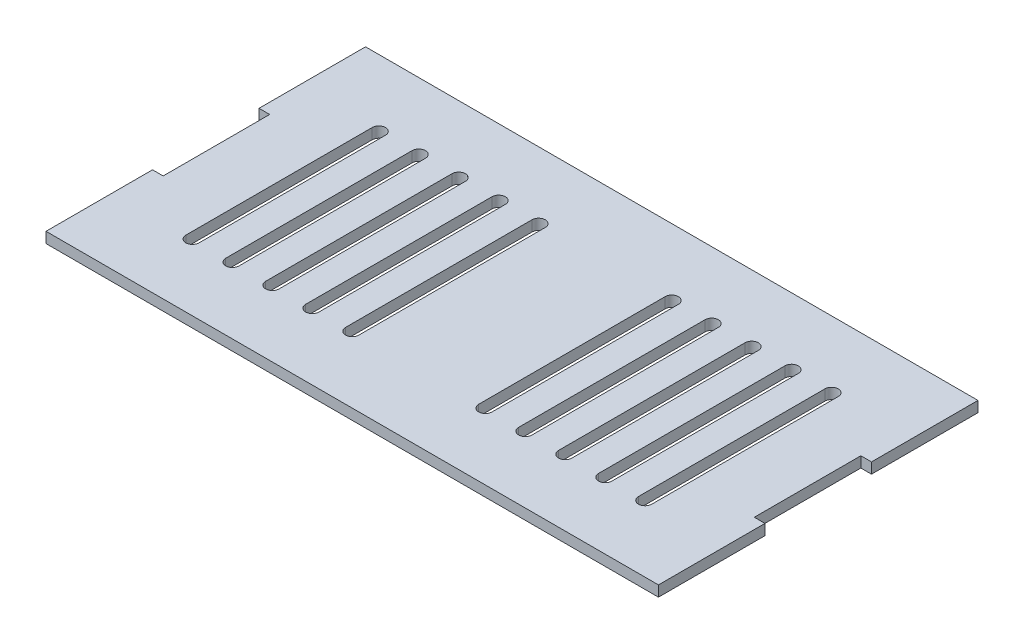
from build123d import *

# Parameters (mm, degrees)
BOSS_EXTRUDE1_DEPTH = 4
CUT_EXTRUDE1_DEPTH  = 4


with BuildPart() as part:
    # Sketch1 → Boss-Extrude1 (new body)
    with BuildSketch(Plane(origin=(0, 0, 0), x_dir=(1, 0, 0), z_dir=(0, 1, 0))):
        Polygon((-115, 60), (115, 60), (115, 20), (111, 20), (111, -20), (115, -20), (115, -60), (-115, -60), (-115, -20), (-111, -20), (-111, 20), (-115, 20), align=None)
    extrude(amount=BOSS_EXTRUDE1_DEPTH)

    # Sketch2 → Cut-Extrude1 (cut)
    with BuildSketch(Plane.XZ):
        with BuildLine():
            Line((-87.5, -35), (-87.5, 35))
            ThreePointArc((-87.5, 35), (-85, 37.5), (-82.5, 35))
            Line((-82.5, 35), (-82.5, -35))
            ThreePointArc((-82.5, -35), (-85, -37.5), (-87.5, -35))
        make_face()
        with BuildLine():
            Line((-72.5, -35), (-72.5, 35))
            ThreePointArc((-72.5, 35), (-70, 37.5), (-67.5, 35))
            Line((-67.5, 35), (-67.5, -35))
            ThreePointArc((-67.5, -35), (-70, -37.5), (-72.5, -35))
        make_face()
        with BuildLine():
            Line((-57.5, -35), (-57.5, 35))
            ThreePointArc((-57.5, 35), (-55, 37.5), (-52.5, 35))
            Line((-52.5, 35), (-52.5, -35))
            ThreePointArc((-52.5, -35), (-55, -37.5), (-57.5, -35))
        make_face()
        with BuildLine():
            Line((-42.5, -35), (-42.5, 35))
            ThreePointArc((-42.5, 35), (-40, 37.5), (-37.5, 35))
            Line((-37.5, 35), (-37.5, -35))
            ThreePointArc((-37.5, -35), (-40, -37.5), (-42.5, -35))
        make_face()
        with BuildLine():
            Line((-27.5, -35), (-27.5, 35))
            ThreePointArc((-27.5, 35), (-25, 37.5), (-22.5, 35))
            Line((-22.5, 35), (-22.5, -35))
            ThreePointArc((-22.5, -35), (-25, -37.5), (-27.5, -35))
        make_face()
        with BuildLine():
            Line((87.5, -35), (87.5, 35))
            ThreePointArc((87.5, 35), (85, 37.5), (82.5, 35))
            Line((82.5, 35), (82.5, -35))
            ThreePointArc((82.5, -35), (85, -37.5), (87.5, -35))
        make_face()
        with BuildLine():
            Line((72.5, -35), (72.5, 35))
            ThreePointArc((72.5, 35), (70, 37.5), (67.5, 35))
            Line((67.5, 35), (67.5, -35))
            ThreePointArc((67.5, -35), (70, -37.5), (72.5, -35))
        make_face()
        with BuildLine():
            Line((57.5, -35), (57.5, 35))
            ThreePointArc((57.5, 35), (55, 37.5), (52.5, 35))
            Line((52.5, 35), (52.5, -35))
            ThreePointArc((52.5, -35), (55, -37.5), (57.5, -35))
        make_face()
        with BuildLine():
            Line((42.5, -35), (42.5, 35))
            ThreePointArc((42.5, 35), (40, 37.5), (37.5, 35))
            Line((37.5, 35), (37.5, -35))
            ThreePointArc((37.5, -35), (40, -37.5), (42.5, -35))
        make_face()
        with BuildLine():
            Line((27.5, -35), (27.5, 35))
            ThreePointArc((27.5, 35), (25, 37.5), (22.5, 35))
            Line((22.5, 35), (22.5, -35))
            ThreePointArc((22.5, -35), (25, -37.5), (27.5, -35))
        make_face()
    extrude(amount=-CUT_EXTRUDE1_DEPTH, mode=Mode.SUBTRACT)


solid = part.part
